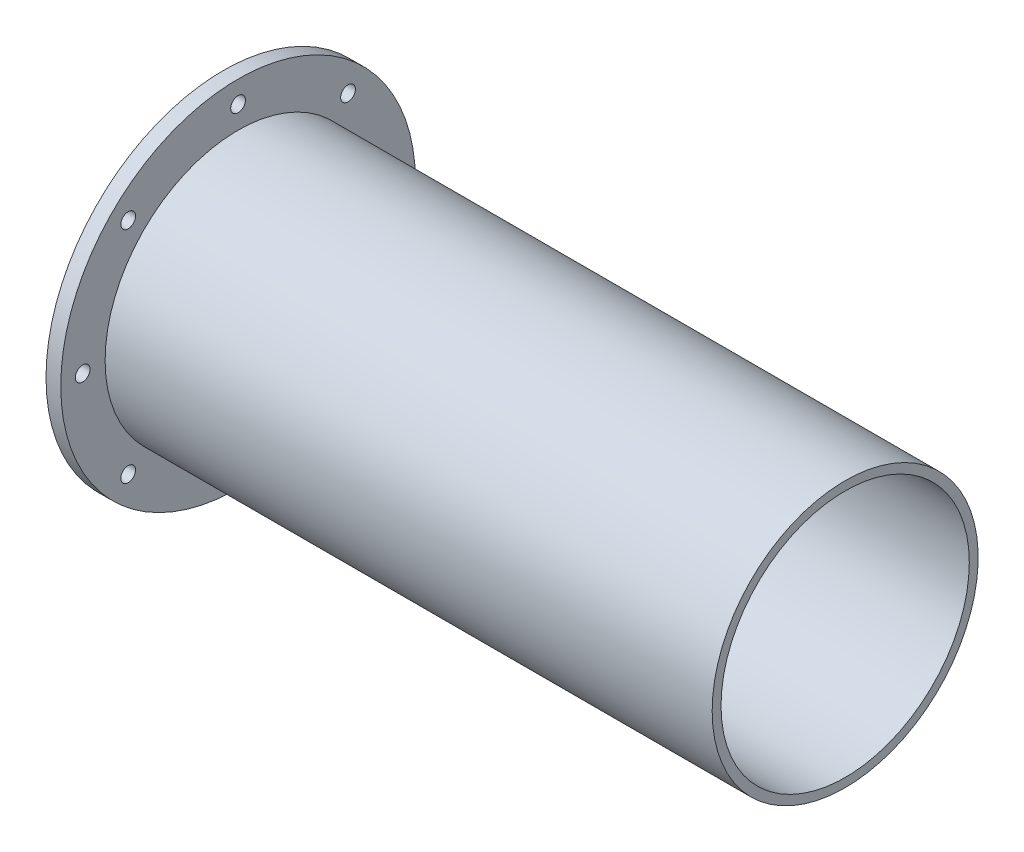
from build123d import *

# Parameters (mm, degrees)
SKETCH2_R          = 3.175
CUT_EXTRUDE1_DEPTH = 283.24063521
CIRPATTERN1_COUNT  = 8


with BuildPart() as part:
    # Sketch1 → Revolve1 (revolve)
    with BuildSketch(Plane.XY, mode=Mode.PRIVATE) as revolve1_sk:
        Polygon((0, 76.2), (6.35, 76.2), (6.35, 57.15), (267.208, 57.15), (267.208, 53.34), (0, 53.34), align=None)
    revolve(revolve1_sk.sketch.rotate(Axis((0, 0, 0), (1, 0, 0)), 90), axis=Axis((0, 0, 0), (1, 0, 0)))

    # Sketch2 → Cut-Extrude1 (cut, through all)
    with BuildSketch(Plane(origin=(6.35, 0, 0), x_dir=(0, 0, -1), z_dir=(1, 0, 0))):
        with Locations((66.802, 0)):
            Circle(SKETCH2_R)
    cut_extrude1 = extrude(amount=-CUT_EXTRUDE1_DEPTH, mode=Mode.SUBTRACT)

    # CirPattern1: Cut-Extrude1 ×8 about axis
    cirpattern1_axis = Axis((0, 0, 0), (-1, 0, 0))
    for i in range(1, CIRPATTERN1_COUNT):
        add(cut_extrude1.rotate(cirpattern1_axis, i * 360 / CIRPATTERN1_COUNT), mode=Mode.SUBTRACT)


solid = part.part
